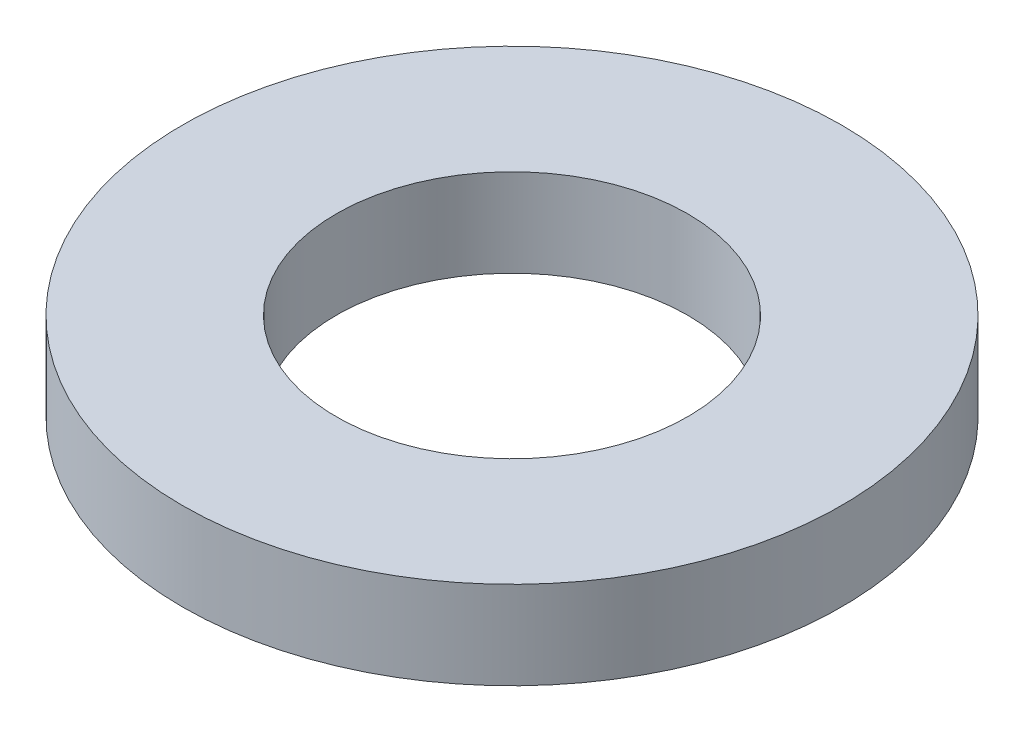
from build123d import *

# Parameters (mm, degrees)
ESQUISSE1_W = 1.4
ESQUISSE1_H = 0.8


with BuildPart() as part:
    # Esquisse1 → Base-Révolution (revolve)
    with BuildSketch(Plane.XY):
        with Locations((2.3, 0.4)):
            Rectangle(ESQUISSE1_W, ESQUISSE1_H)
    revolve(axis=Axis((0, 0, 0), (0, 1, 0)))


solid = part.part
